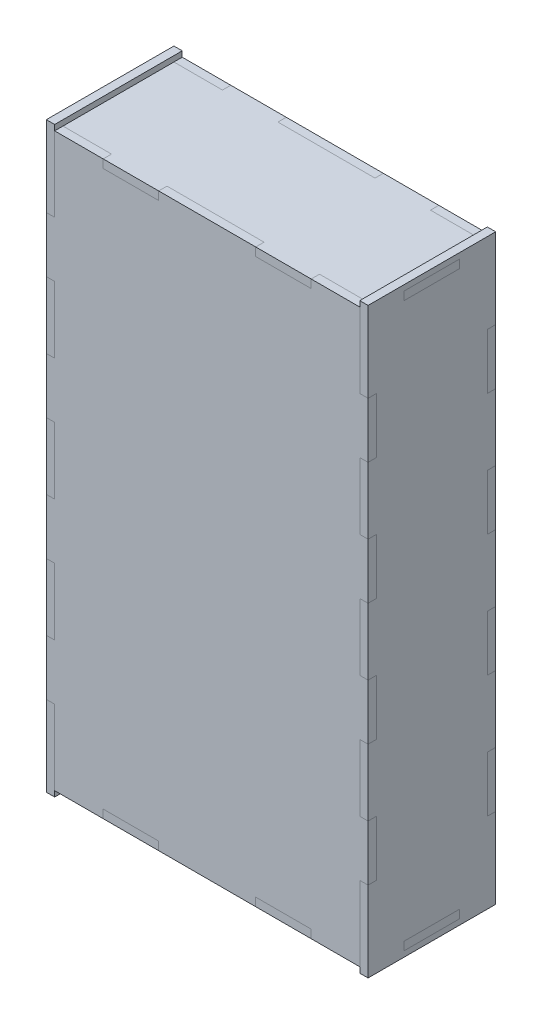
from build123d import *

# Parameters (mm, degrees)
BOSS_EXTRUDE1_DEPTH = 3
SKETCH3_W           = 20
SKETCH3_H           = 3
BOSS_EXTRUDE4_DEPTH = 3
LPATTERN1_COUNT     = 2
LPATTERN1_PITCH     = 113
LPATTERN2_COUNT     = 2
LPATTERN2_PITCH     = 203
BOSS_EXTRUDE6_DEPTH = 3
LPATTERN3_COUNT     = 2
LPATTERN3_PITCH     = 43


with BuildPart() as part:
    # Sketch1 → Boss-Extrude1 (new body)
    with BuildSketch(Plane(origin=(0, 0, 0), x_dir=(1, 0, 0), z_dir=(0, 1, 0))):
        Polygon((0, 0), (17.5, 0), (17.5, -3), (37.5, -3), (37.5, 0), (72.5, 0), (72.5, -3), (92.5, -3), (92.5, 0), (110, 0), (110, 10), (113, 10), (113, 30), (110, 30), (110, 40), (92.5, 40), (92.5, 43), (72.5, 43), (72.5, 40), (37.5, 40), (37.5, 43), (17.5, 43), (17.5, 40), (0, 40), (0, 30), (-3, 30), (-3, 10), (0, 10), align=None)
    extrude(amount=BOSS_EXTRUDE1_DEPTH)


with BuildPart() as body_2:
    # Sketch3 → Boss-Extrude4 (new body)
    with BuildSketch(Plane.ZY.offset(3)):
        Polygon((-43, -2), (-20, -2), (3, -2), (3, 3), (3, 27), (0, 27), (0, 47), (3, 47), (3, 71), (0, 71), (0, 91), (3, 91), (3, 115), (0, 115), (0, 135), (3, 135), (3, 159), (0, 159), (0, 179), (3, 179), (3, 208), (-43, 208), (-43, 179), (-40, 179), (-40, 159), (-43, 159), (-43, 135), (-40, 135), (-40, 115), (-43, 115), (-43, 91), (-40, 91), (-40, 71), (-43, 71), (-43, 47), (-40, 47), (-40, 27), (-43, 27), align=None)
        with Locations((-20, 1.5)):
            Rectangle(SKETCH3_W, SKETCH3_H, mode=Mode.SUBTRACT)
        with Locations((-20, 204.5)):
            Rectangle(SKETCH3_W, SKETCH3_H, mode=Mode.SUBTRACT)
    extrude(amount=-BOSS_EXTRUDE4_DEPTH)


with BuildPart() as lpattern1_1:
    # LPattern1: pattern copy
    add(body_2.part.moved(Location(Vector(1, 0, 0) * (1 * LPATTERN1_PITCH))))


with BuildPart() as lpattern2_1:
    # LPattern2: pattern copy
    add(part.part.moved(Location(Vector(0, 1, 0) * (1 * LPATTERN2_PITCH))))


with BuildPart() as body_5:
    # Sketch6 → Boss-Extrude6 (new body)
    with BuildSketch(Plane.XY.offset(3)):
        Polygon((17.5, 3), (37.5, 3), (37.5, 0), (72.5, 0), (72.5, 3), (92.5, 3), (92.5, 0), (110, 0), (110, 3), (110, 27), (113, 27), (113, 47), (110, 47), (110, 71), (113, 71), (113, 91), (110, 91), (110, 115), (113, 115), (113, 135), (110, 135), (110, 159), (113, 159), (113, 179), (110, 179), (110, 203), (110, 206), (92.5, 206), (92.5, 203), (72.5, 203), (72.5, 206), (37.5, 206), (37.5, 203), (17.5, 203), (17.5, 206), (0, 206), (0, 203), (0, 179), (-3, 179), (-3, 159), (0, 159), (0, 135), (-3, 135), (-3, 115), (0, 115), (0, 91), (-3, 91), (-3, 71), (0, 71), (0, 47), (-3, 47), (-3, 27), (0, 27), (0, 3), (0, 0), (17.5, 0), align=None)
    extrude(amount=-BOSS_EXTRUDE6_DEPTH)


with BuildPart() as lpattern3_1:
    # LPattern3: pattern copy
    add(body_5.part.moved(Location(Vector(0, 0, -1) * (1 * LPATTERN3_PITCH))))


solid = Compound([part.part, body_2.part, lpattern1_1.part, lpattern2_1.part, body_5.part, lpattern3_1.part])
